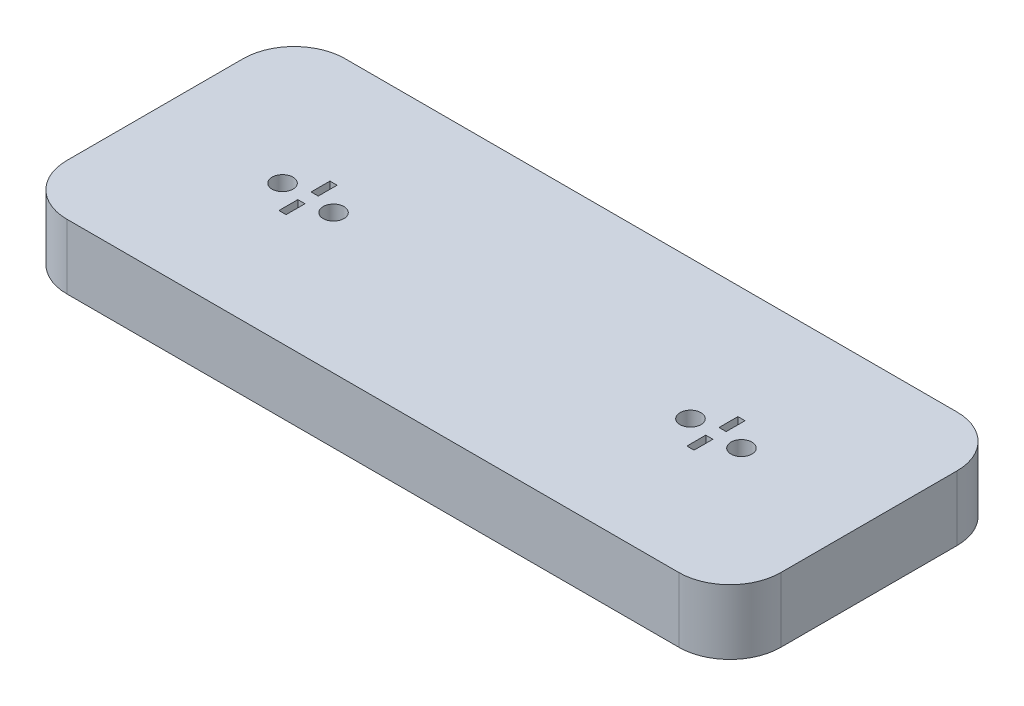
from build123d import *

# Parameters (mm, degrees)
BOSS_EXTRUDE1_DEPTH = 6.35
SKETCH2_R           = 1.025
SKETCH2_W           = 0.7
SKETCH2_H           = 1.85
CUT_EXTRUDE1_DEPTH  = 6.35


with BuildPart() as part:
    # Sketch1 → Boss-Extrude1 (new body)
    with BuildSketch(Plane(origin=(0, 0, 0), x_dir=(1, 0, 0), z_dir=(0, 1, 0))):
        with BuildLine():
            Line((5, 0), (65, 0))
            ThreePointArc((65, 0), (68.535533906, 1.464466094), (70, 5))
            Line((70, 5), (70, 22.27))
            ThreePointArc((70, 22.27), (68.535533906, 25.805533906), (65, 27.27))
            Line((65, 27.27), (5, 27.27))
            ThreePointArc((5, 27.27), (1.464466094, 25.805533906), (0, 22.27))
            Line((0, 22.27), (0, 5))
            ThreePointArc((0, 5), (1.464466094, 1.464466094), (5, 0))
        make_face()
    extrude(amount=BOSS_EXTRUDE1_DEPTH)

    # Sketch2 → Cut-Extrude1 (cut)
    with BuildSketch(Plane(origin=(0, 6.35, 0), x_dir=(1, 0, 0), z_dir=(0, 1, 0))):
        with Locations(Location((12.5, 13.635, 0), (0, 0, 270))):
            Circle(SKETCH2_R)
        with Locations(Location((17.5, 13.635, 0), (0, 0, 270))):
            Circle(SKETCH2_R)
        with Locations(Location((52.5, 13.635, 0), (0, 0, 270))):
            Circle(SKETCH2_R)
        with Locations(Location((57.5, 13.635, 0), (0, 0, 270))):
            Circle(SKETCH2_R)
        with Locations((15, 15.21)):
            Rectangle(SKETCH2_W, SKETCH2_H)
        with Locations((15, 12.06)):
            Rectangle(SKETCH2_W, SKETCH2_H)
        with Locations((55, 12.06)):
            Rectangle(SKETCH2_W, SKETCH2_H)
        with Locations((55, 15.21)):
            Rectangle(SKETCH2_W, SKETCH2_H)
    extrude(amount=-CUT_EXTRUDE1_DEPTH, mode=Mode.SUBTRACT)


solid = part.part
